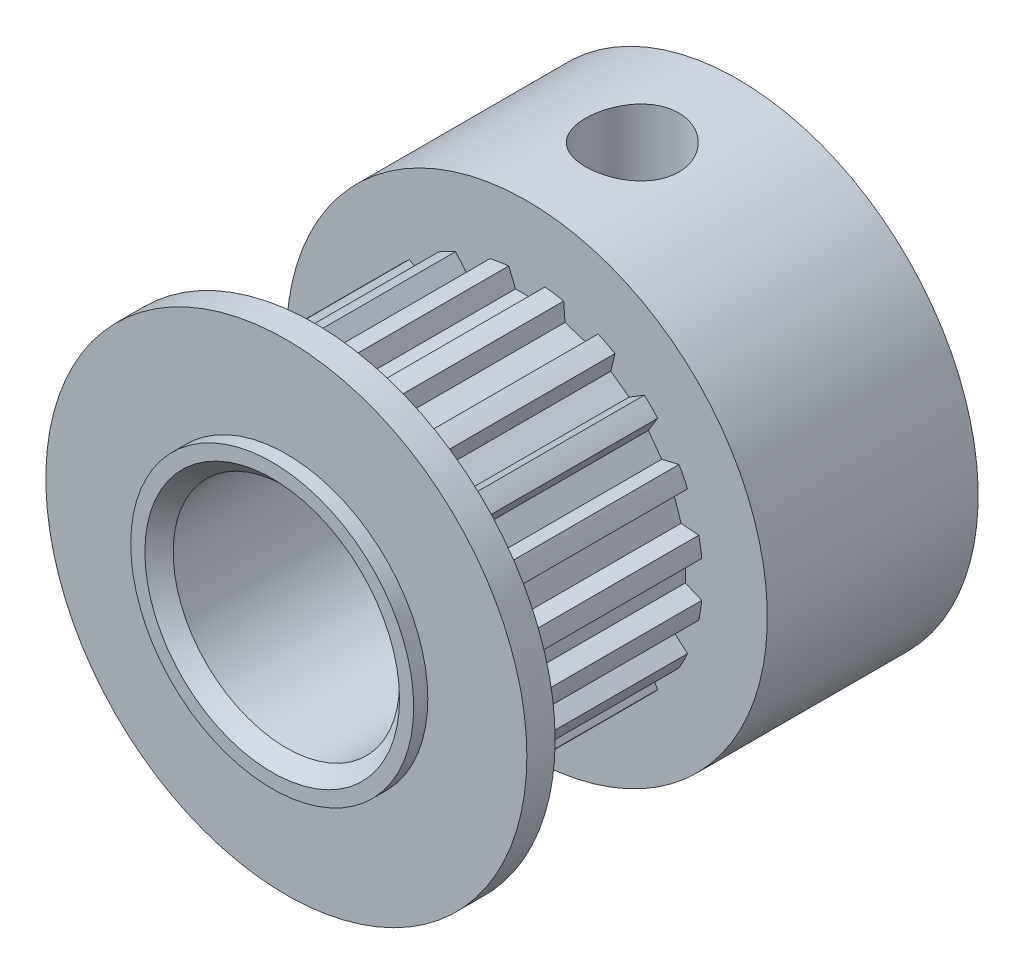
from build123d import *

# Parameters (mm, degrees)
CROQUIS1_W                          = 8.5
CROQUIS1_H                          = 1
SALIENTE_EXTRUIR1_DEPTH             = 7.5
SALIENTE_EXTRUIR2_START             = -7.45
CROQUIS3_R                          = 8.5
SALIENTE_EXTRUIR2_DEPTH             = 7.45
CROQUIS4_R                          = 5
SALIENTE_EXTRUIR3_DEPTH             = 0.5
DI_METRO_DE_TALADRO_8_0_8_1_D       = 8
TALADRO_DE_MARGEN_PARA_M3_51_REACH  = 24.873
TALADRO_DE_MARGEN_PARA_M3_51_BORE_R = 1.65
CHAFL_N1_SIZE                       = 0.5


with BuildPart() as part:
    # Croquis1 → Revolución1 (revolve)
    with BuildSketch(Plane(origin=(0, 0, 0), x_dir=(1, 0, 0), z_dir=(0, 1, 0))):
        with Locations((4.25, -15.45)):
            Rectangle(CROQUIS1_W, CROQUIS1_H)
    revolve(axis=Axis((0, 0, 14.95), (0, 0, 1)))

    # Croquis2 → Saliente-Extruir1 (add)
    with BuildSketch(Plane(origin=(0, 0, 14.95), x_dir=(-1, 0, 0), z_dir=(0, 0, -1))):
        with BuildLine():
            Line((-1.30065941, -6.077376909), (-1.350072562, -5.449523289))
            Line((-1.350072562, -5.449523289), (-2.110917775, -5.202309694))
            Line((-2.110917775, -5.202309694), (-2.519936953, -5.681209621))
            ThreePointArc((-2.519936953, -5.681209621), (-2.821550956, -5.537605548), (-3.115013354, -5.37800305))
            Line((-3.115013354, -5.37800305), (-2.967990615, -4.765609269))
            Line((-2.967990615, -4.765609269), (-3.615204211, -4.295381068))
            Line((-3.615204211, -4.295381068), (-4.152192781, -4.624448087))
            ThreePointArc((-4.152192781, -4.624448087), (-4.394668645, -4.394668645), (-4.624448087, -4.152192781))
            Line((-4.624448087, -4.152192781), (-4.295381068, -3.615204211))
            Line((-4.295381068, -3.615204211), (-4.765609269, -2.967990615))
            Line((-4.765609269, -2.967990615), (-5.37800305, -3.115013354))
            ThreePointArc((-5.37800305, -3.115013354), (-5.537605548, -2.821550956), (-5.681209621, -2.519936953))
            Line((-5.681209621, -2.519936953), (-5.202309694, -2.110917775))
            Line((-5.202309694, -2.110917775), (-5.449523289, -1.350072562))
            Line((-5.449523289, -1.350072562), (-6.077376909, -1.30065941))
            ThreePointArc((-6.077376909, -1.30065941), (-6.138483037, -0.9722402), (-6.181854773, -0.641012138))
            Line((-6.181854773, -0.641012138), (-5.6, -0.4))
            Line((-5.6, -0.4), (-5.6, 0.4))
            Line((-5.6, 0.4), (-6.181854773, 0.641012138))
            ThreePointArc((-6.181854773, 0.641012138), (-6.138483037, 0.9722402), (-6.077376909, 1.30065941))
            Line((-6.077376909, 1.30065941), (-5.449523289, 1.350072562))
            Line((-5.449523289, 1.350072562), (-5.202309694, 2.110917775))
            Line((-5.202309694, 2.110917775), (-5.681209621, 2.519936953))
            ThreePointArc((-5.681209621, 2.519936953), (-5.537605548, 2.821550956), (-5.37800305, 3.115013354))
            Line((-5.37800305, 3.115013354), (-4.765609269, 2.967990615))
            Line((-4.765609269, 2.967990615), (-4.295381068, 3.615204211))
            Line((-4.295381068, 3.615204211), (-4.624448087, 4.152192781))
            ThreePointArc((-4.624448087, 4.152192781), (-4.394668645, 4.394668645), (-4.152192781, 4.624448087))
            Line((-4.152192781, 4.624448087), (-3.615204211, 4.295381068))
            Line((-3.615204211, 4.295381068), (-2.967990615, 4.765609269))
            Line((-2.967990615, 4.765609269), (-3.115013354, 5.37800305))
            ThreePointArc((-3.115013354, 5.37800305), (-2.821550956, 5.537605548), (-2.519936953, 5.681209621))
            Line((-2.519936953, 5.681209621), (-2.110917775, 5.202309694))
            Line((-2.110917775, 5.202309694), (-1.350072562, 5.449523289))
            Line((-1.350072562, 5.449523289), (-1.30065941, 6.077376909))
            ThreePointArc((-1.30065941, 6.077376909), (-0.9722402, 6.138483037), (-0.641012138, 6.181854773))
            Line((-0.641012138, 6.181854773), (-0.4, 5.6))
            Line((-0.4, 5.6), (0.4, 5.6))
            Line((0.4, 5.6), (0.641012138, 6.181854773))
            ThreePointArc((0.641012138, 6.181854773), (0.9722402, 6.138483037), (1.30065941, 6.077376909))
            Line((1.30065941, 6.077376909), (1.350072562, 5.449523289))
            Line((1.350072562, 5.449523289), (2.110917775, 5.202309694))
            Line((2.110917775, 5.202309694), (2.519936953, 5.681209621))
            ThreePointArc((2.519936953, 5.681209621), (2.821550956, 5.537605548), (3.115013354, 5.37800305))
            Line((3.115013354, 5.37800305), (2.967990615, 4.765609269))
            Line((2.967990615, 4.765609269), (3.615204211, 4.295381068))
            Line((3.615204211, 4.295381068), (4.152192781, 4.624448087))
            ThreePointArc((4.152192781, 4.624448087), (4.394668645, 4.394668645), (4.624448087, 4.152192781))
            Line((4.624448087, 4.152192781), (4.295381068, 3.615204211))
            Line((4.295381068, 3.615204211), (4.765609269, 2.967990615))
            Line((4.765609269, 2.967990615), (5.37800305, 3.115013354))
            ThreePointArc((5.37800305, 3.115013354), (5.537605548, 2.821550956), (5.681209621, 2.519936953))
            Line((5.681209621, 2.519936953), (5.202309694, 2.110917775))
            Line((5.202309694, 2.110917775), (5.449523289, 1.350072562))
            Line((5.449523289, 1.350072562), (6.077376909, 1.30065941))
            ThreePointArc((6.077376909, 1.30065941), (6.138483037, 0.9722402), (6.181854773, 0.641012138))
            Line((6.181854773, 0.641012138), (5.6, 0.4))
            Line((5.6, 0.4), (5.6, -0.4))
            Line((5.6, -0.4), (6.181854773, -0.641012138))
            ThreePointArc((6.181854773, -0.641012138), (6.138483037, -0.9722402), (6.077376909, -1.30065941))
            Line((6.077376909, -1.30065941), (5.449523289, -1.350072562))
            Line((5.449523289, -1.350072562), (5.202309694, -2.110917775))
            Line((5.202309694, -2.110917775), (5.681209621, -2.519936953))
            ThreePointArc((5.681209621, -2.519936953), (5.537605548, -2.821550956), (5.37800305, -3.115013354))
            Line((5.37800305, -3.115013354), (4.765609269, -2.967990615))
            Line((4.765609269, -2.967990615), (4.295381068, -3.615204211))
            Line((4.295381068, -3.615204211), (4.624448087, -4.152192781))
            ThreePointArc((4.624448087, -4.152192781), (4.394668645, -4.394668645), (4.152192781, -4.624448087))
            Line((4.152192781, -4.624448087), (3.615204211, -4.295381068))
            Line((3.615204211, -4.295381068), (2.967990615, -4.765609269))
            Line((2.967990615, -4.765609269), (3.115013354, -5.37800305))
            ThreePointArc((3.115013354, -5.37800305), (2.821550956, -5.537605548), (2.519936953, -5.681209621))
            Line((2.519936953, -5.681209621), (2.110917775, -5.202309694))
            Line((2.110917775, -5.202309694), (1.350072562, -5.449523289))
            Line((1.350072562, -5.449523289), (1.30065941, -6.077376909))
            ThreePointArc((1.30065941, -6.077376909), (0.9722402, -6.138483037), (0.641012138, -6.181854773))
            Line((0.641012138, -6.181854773), (0.4, -5.6))
            Line((0.4, -5.6), (-0.4, -5.6))
            Line((-0.4, -5.6), (-0.641012138, -6.181854773))
            ThreePointArc((-0.641012138, -6.181854773), (-0.9722402, -6.138483037), (-1.30065941, -6.077376909))
        make_face()
    extrude(amount=SALIENTE_EXTRUIR1_DEPTH)

    # Croquis3 → Saliente-Extruir2 (add)
    with BuildSketch(Plane.XY.offset(7.45).offset(SALIENTE_EXTRUIR2_START)):
        Circle(CROQUIS3_R)
    extrude(amount=SALIENTE_EXTRUIR2_DEPTH)

    # Croquis4 → Saliente-Extruir3 (add)
    with BuildSketch(Plane.XY.offset(15.95)):
        Circle(CROQUIS4_R)
    extrude(amount=SALIENTE_EXTRUIR3_DEPTH)

    # Diámetro de taladro Ø8.0 (8)1 (through all)
    with Locations(Plane.XY.offset(16.45)):
        with Locations((0, 0)):
            Hole(DI_METRO_DE_TALADRO_8_0_8_1_D / 2)

    # Taladro de margen para M3.51 bore (on position points) → Taladro de margen para M3.51 (cut, up to next)
    with BuildSketch(Plane(origin=(0, 8.5, 3.725), x_dir=(1, 0, 0), z_dir=(0, 1, 0)), mode=Mode.PRIVATE) as taladro_de_margen_para_m3_51_sk1:
        Circle(TALADRO_DE_MARGEN_PARA_M3_51_BORE_R)
    taladro_de_margen_para_m3_51_tool1 = extrude(taladro_de_margen_para_m3_51_sk1.sketch, amount=-TALADRO_DE_MARGEN_PARA_M3_51_REACH, mode=Mode.PRIVATE) & part.part
    add(taladro_de_margen_para_m3_51_tool1.solids().sort_by_distance((0, 8.5, 3.725))[0], mode=Mode.SUBTRACT)

    # Chaflán1
    chafl_n1_edges = [part.edges().sort_by_distance(p)[0] for p in [
        (4, 0, 16.45),
        (4, 0, 0),
    ]]
    chamfer(chafl_n1_edges, length=CHAFL_N1_SIZE)


solid = part.part
